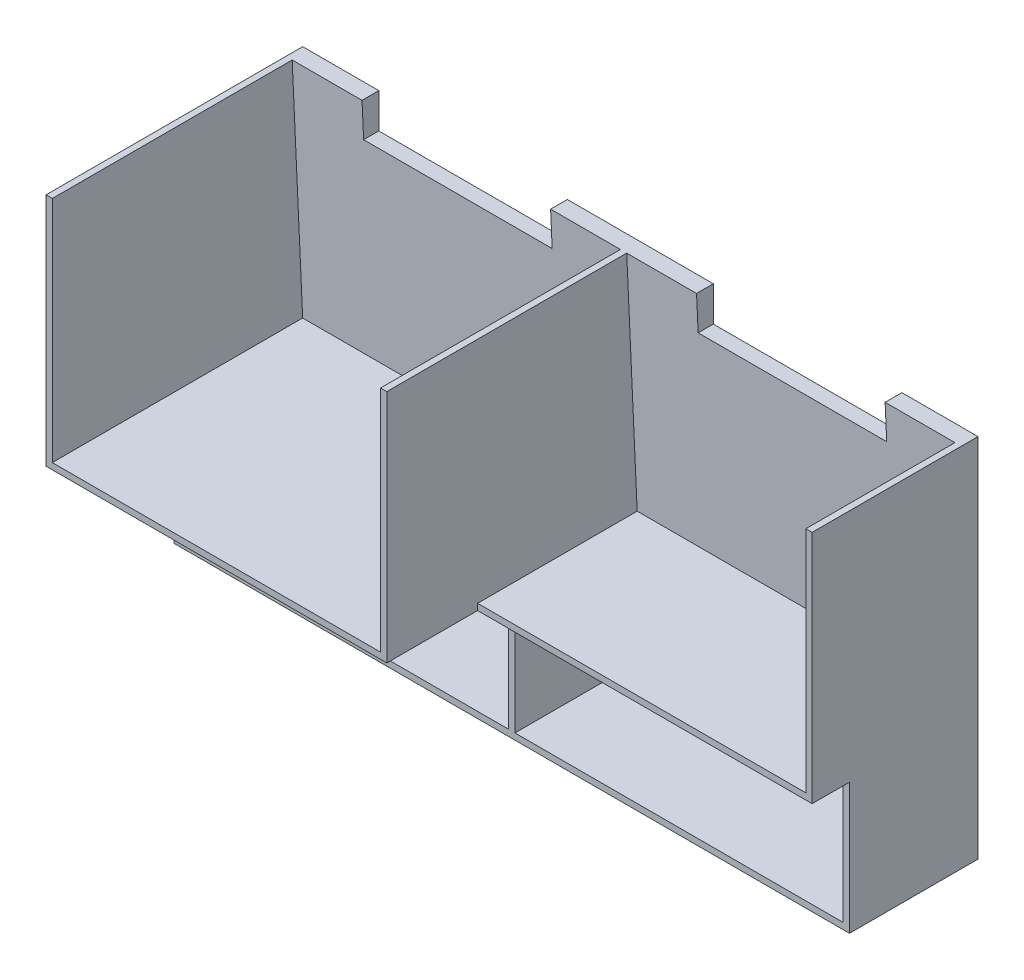
from build123d import *

# Parameters (mm, degrees)
SKETCH1_W               = 193.4
SKETCH1_H               = 104.8
BOSS_EXTRUDE1_DEPTH     = 1.8
SKETCH1_8_W             = 1.8
SKETCH1_8_H             = 65.5
SKETCH1_8_H_2           = 1.8
SKETCH1_8_W_2           = 94
BOSS_EXTRUDE2_DEPTH     = 71.7
SKETCH1_10_W            = 94
SKETCH1_10_H            = 1.8
SKETCH1_10_W_2          = 1.8
SKETCH1_10_H_2          = 65.5
BOSS_EXTRUDE3_DEPTH     = 45.7
BOSS_EXTRUDE4_DEPTH     = 35
BOSS_EXTRUDE8_REACH     = 231.858
CUT_EXTRUDE1_DEPTH      = 27
CUT_EXTRUDE1_DEPTH_BACK = 16
SKETCH1_12_W            = 54
SKETCH1_12_H            = 10


with BuildPart() as part:
    # Sketch1 → Boss-Extrude1 (new body)
    with BuildSketch(Plane.XY):
        with Locations((96.7, 52.4)):
            Rectangle(SKETCH1_W, SKETCH1_H)
    extrude(amount=-BOSS_EXTRUDE1_DEPTH)

    # Sketch1<8> → Boss-Extrude2 (add)
    with BuildSketch(Plane.XY):
        with Locations((96.7, 72.05)):
            Rectangle(SKETCH1_8_W, SKETCH1_8_H)
        with Locations((96.7, 38.4)):
            Rectangle(SKETCH1_8_W, SKETCH1_8_H_2)
        with Locations((48.8, 38.4)):
            Rectangle(SKETCH1_8_W_2, SKETCH1_8_H_2)
        with Locations((0.9, 72.05)):
            Rectangle(SKETCH1_8_W, SKETCH1_8_H)
        with Locations((0.9, 38.4)):
            Rectangle(SKETCH1_8_W, SKETCH1_8_H_2)
    extrude(amount=BOSS_EXTRUDE2_DEPTH)

    # Sketch1<10> → Boss-Extrude3 (add)
    with BuildSketch(Plane.XY):
        with Locations((144.6, 38.4)):
            Rectangle(SKETCH1_10_W, SKETCH1_10_H)
        with Locations((192.5, 72.05)):
            Rectangle(SKETCH1_10_W_2, SKETCH1_10_H_2)
        with Locations((192.5, 38.4)):
            Rectangle(SKETCH1_10_W_2, SKETCH1_10_H)
    extrude(amount=BOSS_EXTRUDE3_DEPTH)

    # Sketch1<11> → Boss-Extrude4 (add)
    with BuildSketch(Plane.XY):
        Polygon((0, 37.5), (0, 0), (193.4, 0), (193.4, 37.5), (191.6, 37.5), (191.6, 1.8), (97.6, 1.8), (97.6, 37.5), (95.8, 37.5), (95.8, 1.8), (1.8, 1.8), (1.8, 37.5), align=None)
    extrude(amount=BOSS_EXTRUDE4_DEPTH)

    # Boss-Extrude8: up to this face of the body (flat: up to its plane)
    boss_extrude8_end = Plane(part.part.faces().sort_by_distance((1.8, 72.05, 35.85))[0])
    # Sketch2 → Boss-Extrude8 (add, up to the picked face)
    with BuildSketch(Plane.ZY.offset(-191.6), mode=Mode.PRIVATE) as boss_extrude8_sk1:
        Polygon((3, 104.8), (0, 104.8), (0, 39.3), align=None)
    boss_extrude8_tool1 = split(extrude(boss_extrude8_sk1.sketch, amount=BOSS_EXTRUDE8_REACH, mode=Mode.PRIVATE), bisect_by=boss_extrude8_end, keep=Keep.BOTH, mode=Mode.PRIVATE)
    add(boss_extrude8_tool1.solids().sort_by(Axis((191.6, 82.966667, 1), (-1, 0, 0)))[0])

    # Sketch1<12> → Cut-Extrude1 (cut, two sides: drawn at the far end of the back side and taken through both)
    with BuildSketch(Plane.XY.offset(-CUT_EXTRUDE1_DEPTH_BACK)):
        with Locations((144.6, 99.8)):
            Rectangle(SKETCH1_12_W, SKETCH1_12_H)
        with Locations((48.8, 99.8)):
            Rectangle(SKETCH1_12_W, SKETCH1_12_H)
    extrude(amount=CUT_EXTRUDE1_DEPTH + CUT_EXTRUDE1_DEPTH_BACK, mode=Mode.SUBTRACT)


solid = part.part
